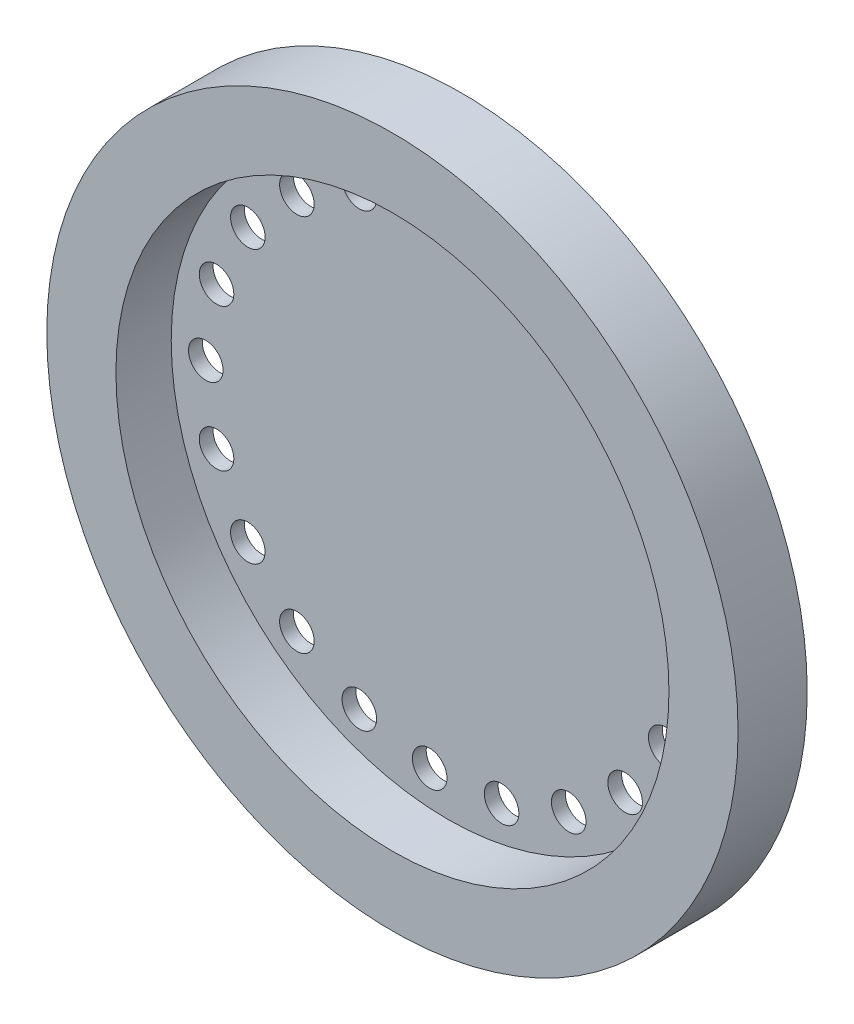
from build123d import *

# Parameters (mm, degrees)
SKETCH4_R           = 63.5
SKETCH4_R_2         = 50.8
BOSS_EXTRUDE4_DEPTH = 12.7
SKETCH1_R           = 50.8
SKETCH1_R_2         = 3.175
BOSS_EXTRUDE5_DEPTH = 2.54


with BuildPart() as part:
    # Sketch4 → Boss-Extrude4 (new body)
    with BuildSketch(Plane.XY):
        Circle(SKETCH4_R)
        Circle(SKETCH4_R_2, mode=Mode.SUBTRACT)
    extrude(amount=BOSS_EXTRUDE4_DEPTH)

    # Sketch1 → Boss-Extrude5 (add)
    with BuildSketch(Plane.XY):
        Circle(SKETCH1_R)
        with Locations((-44.45, 0)):
            Circle(SKETCH1_R_2, mode=Mode.SUBTRACT)
        with Locations((-42.475211217, 13.101867503)):
            Circle(SKETCH1_R_2, mode=Mode.SUBTRACT)
        with Locations((-36.726313518, 25.039576581)):
            Circle(SKETCH1_R_2, mode=Mode.SUBTRACT)
        with Locations((-27.714121693, 34.752409396)):
            Circle(SKETCH1_R_2, mode=Mode.SUBTRACT)
        with Locations((-16.239408533, 41.377338127)):
            Circle(SKETCH1_R_2, mode=Mode.SUBTRACT)
        with Locations((-3.32175266, 44.325708785)):
            Circle(SKETCH1_R_2, mode=Mode.SUBTRACT)
        with Locations((9.891055514, 43.335545696)):
            Circle(SKETCH1_R_2, mode=Mode.SUBTRACT)
        with Locations((22.225, 38.494829198)):
            Circle(SKETCH1_R_2, mode=Mode.SUBTRACT)
        with Locations((32.584155703, 30.233678194)):
            Circle(SKETCH1_R_2, mode=Mode.SUBTRACT)
        with Locations((40.048066178, 19.286132204)):
            Circle(SKETCH1_R_2, mode=Mode.SUBTRACT)
        with Locations((43.953530226, 6.624928732)):
            Circle(SKETCH1_R_2, mode=Mode.SUBTRACT)
        with Locations((43.953530226, -6.624928732)):
            Circle(SKETCH1_R_2, mode=Mode.SUBTRACT)
        with Locations((40.048066178, -19.286132204)):
            Circle(SKETCH1_R_2, mode=Mode.SUBTRACT)
        with Locations((32.584155703, -30.233678194)):
            Circle(SKETCH1_R_2, mode=Mode.SUBTRACT)
        with Locations((22.225, -38.494829198)):
            Circle(SKETCH1_R_2, mode=Mode.SUBTRACT)
        with Locations((9.891055514, -43.335545696)):
            Circle(SKETCH1_R_2, mode=Mode.SUBTRACT)
        with Locations((-3.32175266, -44.325708785)):
            Circle(SKETCH1_R_2, mode=Mode.SUBTRACT)
        with Locations((-16.239408533, -41.377338127)):
            Circle(SKETCH1_R_2, mode=Mode.SUBTRACT)
        with Locations((-27.714121693, -34.752409396)):
            Circle(SKETCH1_R_2, mode=Mode.SUBTRACT)
        with Locations((-36.726313518, -25.039576581)):
            Circle(SKETCH1_R_2, mode=Mode.SUBTRACT)
        with Locations((-42.475211217, -13.101867503)):
            Circle(SKETCH1_R_2, mode=Mode.SUBTRACT)
    extrude(amount=BOSS_EXTRUDE5_DEPTH)


solid = part.part
